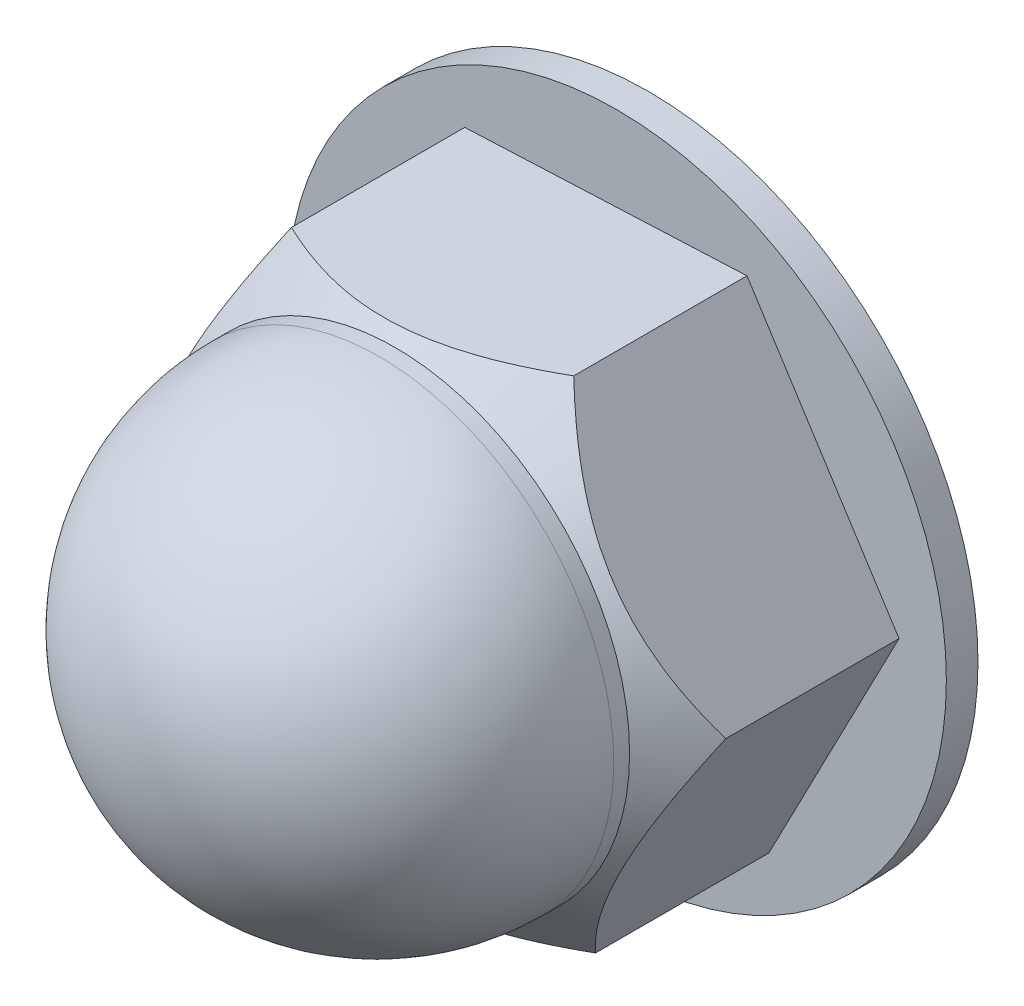
from build123d import *

# Parameters (mm, degrees)
SKETCH2_R           = 20.831287801
BOSS_EXTRUDE1_DEPTH = 2
BOSS_EXTRUDE2_DEPTH = 14
SKETCH4_R           = 20.916131801
SKETCH4_R_2         = 14.810913562
CUT_EXTRUDE1_DEPTH  = 14
CUT_EXTRUDE1_DRAFT  = -45
SKETCH5_R           = 14.810913562
BOSS_EXTRUDE3_DEPTH = 1
DOME1_FACE_RADIUS   = 14.810913562
DOME1_HEIGHT        = 15


with BuildPart() as part:
    # Sketch2 → Boss-Extrude1 (new body)
    with BuildSketch(Plane.XY):
        with Locations((74.414862174, 117.331579563)):
            Circle(SKETCH2_R)
    extrude(amount=BOSS_EXTRUDE1_DEPTH)

    # Sketch3 → Boss-Extrude2 (add)
    with BuildSketch(Plane.XY.offset(2)):
        Polygon((82.644465075, 133.181309802), (64.803394594, 132.383489858), (56.573791693, 116.533759619), (66.185259272, 101.481849324), (84.026329753, 102.279669268), (92.255932654, 118.129399507), align=None)
    extrude(amount=BOSS_EXTRUDE2_DEPTH)


with BuildPart() as cut_extrude1_tool:
    # Sketch4 → Cut-Extrude1 (with draft: the straight prism first)
    with BuildSketch(Plane.XY.offset(16)):
        with Locations((74.414862174, 117.331579563)):
            Circle(SKETCH4_R)
        with Locations((74.414862174, 117.331579563)):
            Circle(SKETCH4_R_2, mode=Mode.SUBTRACT)
    extrude(amount=-CUT_EXTRUDE1_DEPTH)
    # Cut-Extrude1: the draft: its side faces are tilted about the plane it starts from
    cut_extrude1_sides = [cut_extrude1_tool.faces().sort_by_distance(p)[0] for p in [
        (53.498730373, 117.331579563, 9),
        (59.603948612, 117.331579563, 9),
    ]]
    draft(cut_extrude1_sides, Plane.XY.offset(16), CUT_EXTRUDE1_DRAFT)


with BuildPart() as part_1:
    add(part.part)

    # Cut-Extrude1: cut by cut_extrude1_tool
    add(cut_extrude1_tool.part, mode=Mode.SUBTRACT)

    # Sketch5 → Boss-Extrude3 (add)
    with BuildSketch(Plane.XY.offset(16)):
        with Locations((74.414862174, 117.331579563)):
            Circle(SKETCH5_R)
    extrude(amount=BOSS_EXTRUDE3_DEPTH)

    # Dome1: an elliptical dome of height H over a round flat face of radius A is half a spheroid: the quarter ellipse of half axes A and H revolved about the face's axis
    with BuildSketch(Plane((74.414862174, 117.331579563, 17), x_dir=(0, 1, 0), z_dir=(1, 0, 0)), mode=Mode.PRIVATE) as dome1_quarter:
        Ellipse(DOME1_FACE_RADIUS, DOME1_HEIGHT)
        Rectangle(DOME1_FACE_RADIUS, DOME1_HEIGHT, align=(Align.MIN, Align.MIN), mode=Mode.INTERSECT)
    revolve(dome1_quarter.sketch, axis=Axis((74.414862174, 117.331579563, 17), (0, 0, 1)))


solid = part_1.part
